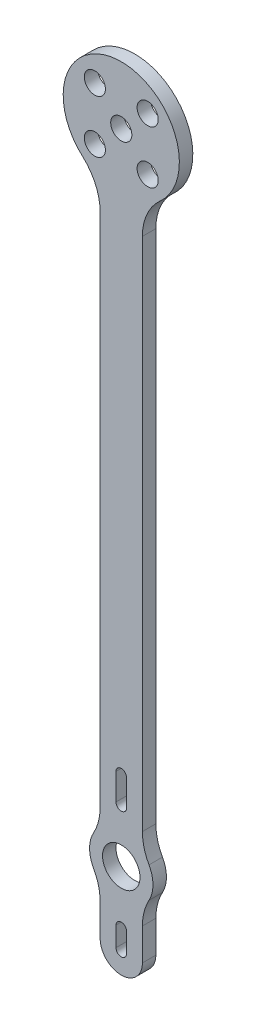
from build123d import *

# Parameters (mm, degrees)
MODEL_R             = 3.55
MODEL_R_2           = 2
BOSS_EXTRUDE1_DEPTH = 2.55


with BuildPart() as part:
    # Model → Boss-Extrude1 (new body)
    with BuildSketch(Plane.XY):
        with BuildLine():
            Line((-4, 105.347524158), (-4, 7.745966692))
            ThreePointArc((-4, 7.745966692), (-4.317541634, 5.245966692), (-5.25, 2.90473751))
            ThreePointArc((-5.25, 2.90473751), (-6, 0), (-5.25, -2.90473751))
            ThreePointArc((-5.25, -2.90473751), (-4.317541634, -5.245966692), (-4, -7.745966692))
            Line((-4, -7.745966692), (-4, -13.8))
            ThreePointArc((-4, -13.8), (0, -17.8), (4, -13.8))
            Line((4, -13.8), (4, -7.745966692))
            ThreePointArc((4, -7.745966692), (4.317541634, -5.245966692), (5.25, -2.90473751))
            ThreePointArc((5.25, -2.90473751), (6, 0), (5.25, 2.90473751))
            ThreePointArc((5.25, 2.90473751), (4.317541634, 5.245966692), (4, 7.745966692))
            Line((4, 7.745966692), (4, 105.347524158))
            ThreePointArc((4, 105.347524158), (4.871290708, 109.430007062), (7.333333333, 112.801084083))
            ThreePointArc((7.333333333, 112.801084083), (0, 132), (-7.333333333, 112.801084083))
            ThreePointArc((-7.333333333, 112.801084083), (-4.871290708, 109.430007062), (-4, 105.347524158))
        make_face()
        Circle(MODEL_R, mode=Mode.SUBTRACT)
        with Locations((0, 121)):
            Circle(MODEL_R_2, mode=Mode.SUBTRACT)
        with Locations((-5, 126)):
            Circle(MODEL_R_2, mode=Mode.SUBTRACT)
        with Locations((5, 126)):
            Circle(MODEL_R_2, mode=Mode.SUBTRACT)
        with Locations((5, 116)):
            Circle(MODEL_R_2, mode=Mode.SUBTRACT)
        with Locations((-5, 116)):
            Circle(MODEL_R_2, mode=Mode.SUBTRACT)
        with BuildLine():
            Line((-1, -10.1), (-1, -13.8))
            ThreePointArc((-1, -13.8), (0, -14.8), (1, -13.8))
            Line((1, -13.8), (1, -10.1))
            ThreePointArc((1, -10.1), (0, -9.1), (-1, -10.1))
        make_face(mode=Mode.SUBTRACT)
        with BuildLine():
            Line((-1, 15.1), (-1, 10.1))
            ThreePointArc((-1, 10.1), (0, 9.1), (1, 10.1))
            Line((1, 10.1), (1, 15.1))
            ThreePointArc((1, 15.1), (0, 16.1), (-1, 15.1))
        make_face(mode=Mode.SUBTRACT)
    extrude(amount=BOSS_EXTRUDE1_DEPTH)


solid = part.part
